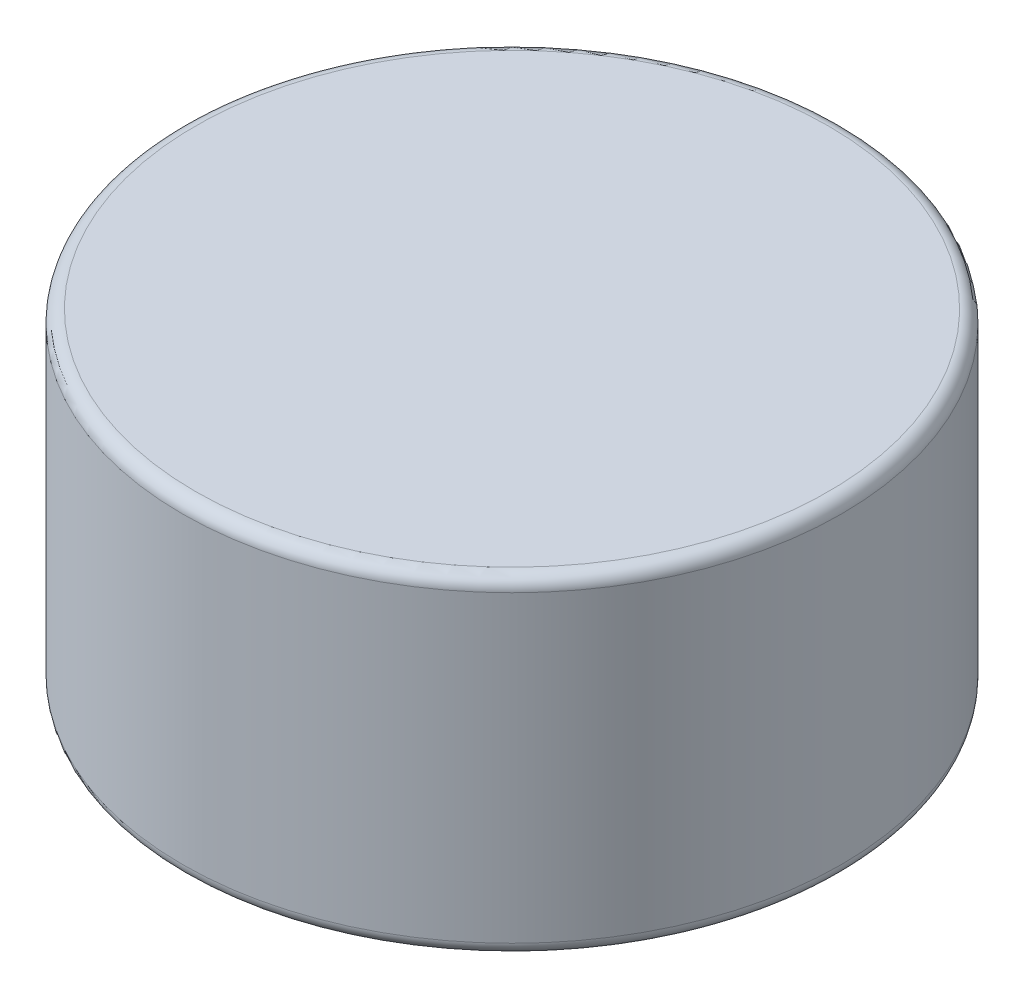
from build123d import *

# Parameters (mm, degrees)
SKETCH1_R           = 12.7
BOSS_EXTRUDE1_DEPTH = 6.35
FILLET1_R           = 0.5


with BuildPart() as part:
    # Sketch1 → Boss-Extrude1 (new, symmetric)
    with BuildSketch(Plane(origin=(0, 0, 0), x_dir=(1, 0, 0), z_dir=(0, 1, 0))):
        with Locations(Location((0, 0, 0), (0, 0, 270))):
            Circle(SKETCH1_R)
    extrude(amount=BOSS_EXTRUDE1_DEPTH, both=True)

    # Fillet1
    fillet1_edges = [part.edges().sort_by_distance(p)[0] for p in [
        (0, -6.35, -12.7),
        (0, 6.35, -12.7),
    ]]
    fillet(fillet1_edges, radius=FILLET1_R)


solid = part.part
